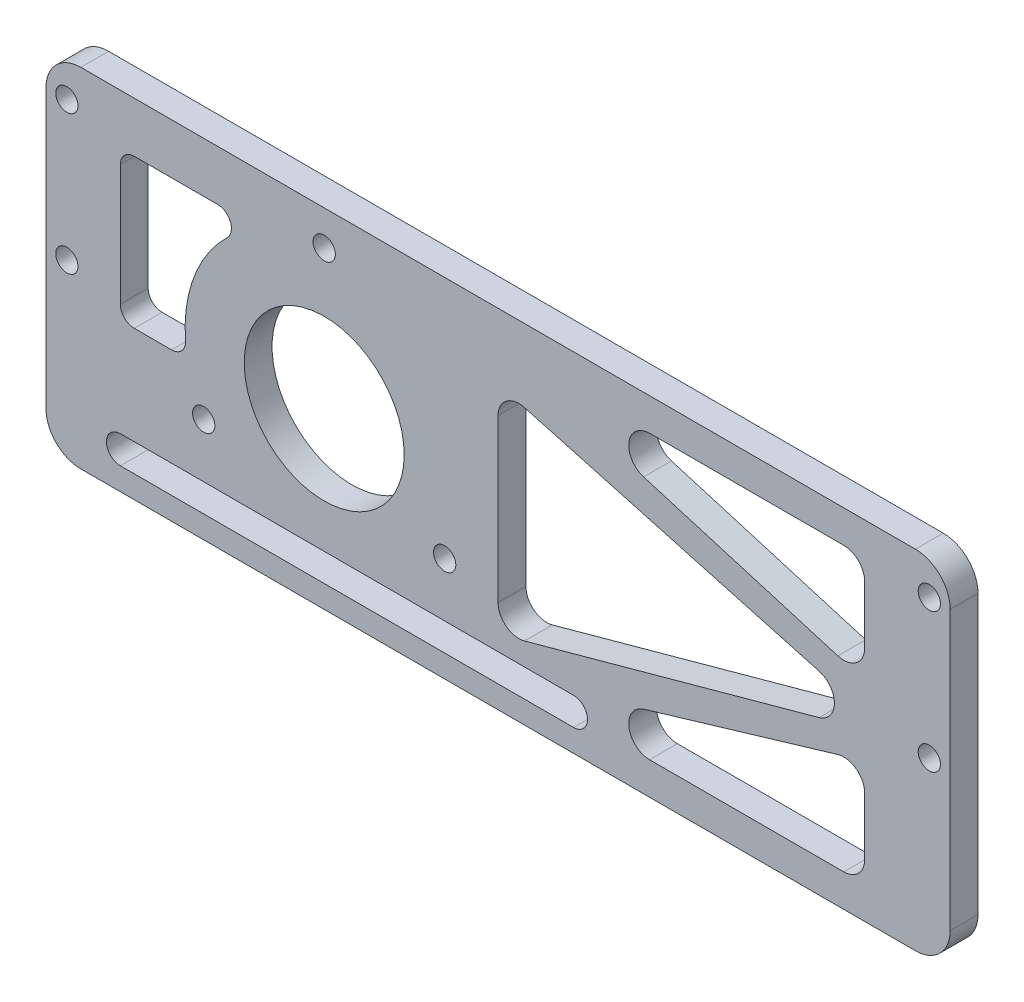
from build123d import *

# Parameters (mm, degrees)
SKETCH_1_W          = 130
SKETCH_1_H          = 50
SKETCH_1_R          = 11.5
SKETCH_1_R_2        = 1.6
EXTRUDE_1_DEPTH     = 2
SKETCH_2_R          = 1.6
CUT_EXTRUDE_1_DEPTH = 70.756720106
FILLET_1_R          = 5
CUT_EXTRUDE_2_DEPTH = 70.756720106
FILLET_2_R          = 3
CUT_EXTRUDE_3_DEPTH = 70.756720106
FILLET_3_R          = 2


with BuildPart() as part:
    # 草图1 → 凸台-拉伸1 (new, symmetric)
    with BuildSketch(Plane.XY):
        Rectangle(SKETCH_1_W, SKETCH_1_H)
        with Locations((-25, 0)):
            Circle(SKETCH_1_R, mode=Mode.SUBTRACT)
        with Locations((-25, 20)):
            Circle(SKETCH_1_R_2, mode=Mode.SUBTRACT)
        with Locations((-7.679491924, -10)):
            Circle(SKETCH_1_R_2, mode=Mode.SUBTRACT)
        with Locations((-42.320508076, -10)):
            Circle(SKETCH_1_R_2, mode=Mode.SUBTRACT)
    extrude(amount=EXTRUDE_1_DEPTH, both=True)

    # 草图2 → 切除-拉伸1 (cut, through all)
    with BuildSketch(Plane.XY.offset(2)):
        with Locations((-62, 0)):
            Circle(SKETCH_2_R)
        with Locations((-62, 20)):
            Circle(SKETCH_2_R)
        with Locations(Location((62, 0, 0), (0, 0, 180))):
            Circle(SKETCH_2_R)
        with Locations(Location((62, 20, 0), (0, 0, 180))):
            Circle(SKETCH_2_R)
    extrude(amount=-CUT_EXTRUDE_1_DEPTH, mode=Mode.SUBTRACT)

    # 圆角1
    fillet_1_edges = [part.edges().sort_by_distance(p)[0] for p in [
        (65, -25, 0),
        (-65, -25, 0),
        (-65, 25, 0),
        (65, 25, 0),
    ]]
    fillet(fillet_1_edges, radius=FILLET_1_R)

    # 草图3 → 切除-拉伸2 (cut, through all)
    with BuildSketch(Plane.XY.offset(2)):
        Polygon((0, -15.574230951), (0, 15.574230951), (56.674910039, 0), align=None)
        Polygon((52.704928418, -20.329043818), (1.183129779, -20.329043818), (52.704928418, -4.996701006), align=None)
        Polygon((1.183129779, 20.329043818), (52.704928418, 4.996701006), (52.704928418, 20.329043818), align=None)
    extrude(amount=-CUT_EXTRUDE_2_DEPTH, mode=Mode.SUBTRACT)

    # 圆角2
    fillet_2_edges = [part.edges().sort_by_distance(p)[0] for p in [
        (1.183129779, 20.329043818, 0),
        (52.704928418, 20.329043818, 0),
        (52.704928418, 4.996701006, 0),
        (52.704928418, -4.996701006, 0),
        (52.704928418, -20.329043818, 0),
        (1.183129779, -20.329043818, 0),
        (56.674910039, 0, 0),
        (0, -15.574230951, 0),
        (0, 15.574230951, 0),
    ]]
    fillet(fillet_2_edges, radius=FILLET_2_R)

    # 草图4 → 切除-拉伸3 (cut, through all)
    with BuildSketch(Plane.XY.offset(2)):
        with BuildLine():
            Line((-34.180193003, 17.76862562), (-54.308419113, 17.76862562))
            Line((-54.308419113, 17.76862562), (-54.308419113, -3.656277433))
            Line((-54.308419113, -3.656277433), (-44.66295083, -3.656277433))
            ThreePointArc((-44.66295083, -3.656277433), (-42.964920101, 8.789860395), (-34.180193003, 17.76862562))
        make_face()
        with BuildLine():
            Line((-54.308419113, -17.77082873), (10.857927113, -17.77082873))
            ThreePointArc((10.857927113, -17.77082873), (12.857927113, -19.77082873), (10.857927113, -21.77082873))
            Line((10.857927113, -21.77082873), (-54.308419113, -21.77082873))
            ThreePointArc((-54.308419113, -21.77082873), (-56.308419113, -19.77082873), (-54.308419113, -17.77082873))
        make_face()
    extrude(amount=-CUT_EXTRUDE_3_DEPTH, mode=Mode.SUBTRACT)

    # 圆角3
    fillet_3_edges = [part.edges().sort_by_distance(p)[0] for p in [
        (-34.180193003, 17.76862562, 0),
        (-44.66295083, -3.656277433, 0),
        (-54.308419113, -3.656277433, 0),
        (-54.308419113, 17.76862562, 0),
    ]]
    fillet(fillet_3_edges, radius=FILLET_3_R)


solid = part.part
